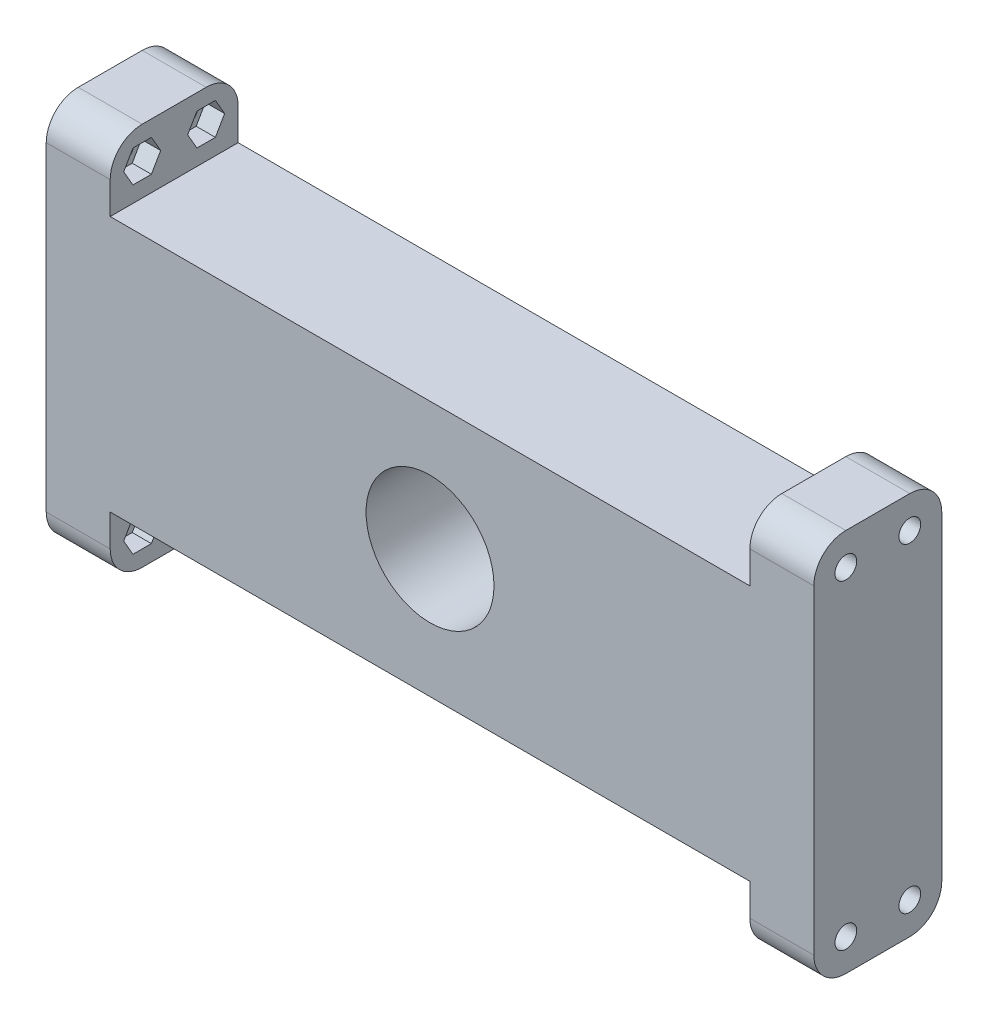
from build123d import *

# Parameters (mm, degrees)
SKETCH1_W                                  = 120
SKETCH1_H                                  = 60
BOSS_EXTRUDE1_DEPTH                        = 10
CUT_EXTRUDE1_DEPTH                         = 71
CUT_EXTRUDE1_DEPTH_BACK                    = 71
SKETCH2_W                                  = 100
SKETCH2_H                                  = 10
FILLET1_R                                  = 5
SKETCH4_R                                  = 1.7
CUT_EXTRUDE3_DEPTH                         = 115.455231423
CUT_EXTRUDE4_DEPTH                         = 3
MIRROR1_AT_THE_SECOND_PLANE_COPY_1_SKETC_R = 1.7
MIRROR1_AT_THE_SECOND_PLANE_COPY_1_DEPTH   = 115.455231423
MIRROR1_AT_THE_SECOND_PLANE_COPY_2_DEPTH   = 3
MIRROR2_COPY_1_SKETCH_R                    = 1.7
MIRROR2_COPY_1_DEPTH                       = 115.455231423
MIRROR2_COPY_2_DEPTH                       = 3
MIRROR2_COPY_3_SKETCH_R                    = 1.7
MIRROR2_COPY_3_DEPTH                       = 115.455231423
MIRROR2_COPY_4_DEPTH                       = 3
MIRROR2_COPY_5_SKETCH_R                    = 1.7
MIRROR2_COPY_5_DEPTH                       = 115.455231423
MIRROR2_COPY_6_DEPTH                       = 3
MIRROR2_COPY_7_SKETCH_R                    = 1.7
MIRROR2_COPY_7_DEPTH                       = 115.455231423
SKETCH6_R                                  = 10
CUT_EXTRUDE5_DEPTH                         = 71


with BuildPart() as part:
    # Sketch1 → Boss-Extrude1 (new, symmetric)
    with BuildSketch(Plane.XY):
        Rectangle(SKETCH1_W, SKETCH1_H)
    extrude(amount=BOSS_EXTRUDE1_DEPTH, both=True)

    # Sketch2 → Cut-Extrude1 (cut, two sides: drawn at the far end of the back side and taken through both)
    with BuildSketch(Plane.XY.offset(10).offset(-CUT_EXTRUDE1_DEPTH_BACK)):
        with Locations((0, -25)):
            Rectangle(SKETCH2_W, SKETCH2_H)
        with Locations((0, 25)):
            Rectangle(SKETCH2_W, SKETCH2_H)
    extrude(amount=CUT_EXTRUDE1_DEPTH + CUT_EXTRUDE1_DEPTH_BACK, mode=Mode.SUBTRACT)

    # Fillet1
    fillet1_edges = [part.edges().sort_by_distance(p)[0] for p in [
        (55, -30, -10),
        (-55, 30, -10),
        (-55, -30, 10),
        (-55, 30, 10),
        (55, -30, 10),
        (-55, -30, -10),
        (55, 30, -10),
        (55, 30, 10),
    ]]
    fillet(fillet1_edges, radius=FILLET1_R)

    # Sketch4 → Cut-Extrude3 (cut, symmetric)
    with BuildSketch(Plane.ZY.offset(-50)):
        with Locations((-5, 25)):
            Circle(SKETCH4_R)
    cut_extrude3 = extrude(amount=CUT_EXTRUDE3_DEPTH, both=True, mode=Mode.SUBTRACT)

    # Sketch5 → Cut-Extrude4 (cut)
    with BuildSketch(Plane.ZY.offset(-50)):
        Polygon((-7.886751346, 25), (-6.443375673, 22.5), (-3.556624327, 22.5), (-2.113248654, 25), (-3.556624327, 27.5), (-6.443375673, 27.5), align=None)
    cut_extrude4 = extrude(amount=-CUT_EXTRUDE4_DEPTH, mode=Mode.SUBTRACT)

    # Mirror1: Cut-Extrude3, Cut-Extrude4 across plane
    add(cut_extrude3.mirror(Plane(origin=(0, 0, 0), x_dir=(0, 0, 1), z_dir=(1, 0, 0))), mode=Mode.SUBTRACT)
    add(cut_extrude4.mirror(Plane(origin=(0, 0, 0), x_dir=(0, 0, 1), z_dir=(1, 0, 0))), mode=Mode.SUBTRACT)

    # Mirror1 at the second plane: Cut-Extrude3, Cut-Extrude4 across plane
    add(cut_extrude3.mirror(Plane.XY), mode=Mode.SUBTRACT)
    add(cut_extrude4.mirror(Plane.XY), mode=Mode.SUBTRACT)

    # Mirror1 at the second plane copy 1 sketc → Mirror1 at the second plane copy 1 (cut, symmetric)
    with BuildSketch(Plane(origin=(-50, 0, 0), x_dir=(0, 0, -1), z_dir=(1, 0, 0))):
        with Locations((-5, 25)):
            Circle(MIRROR1_AT_THE_SECOND_PLANE_COPY_1_SKETC_R)
    extrude(amount=MIRROR1_AT_THE_SECOND_PLANE_COPY_1_DEPTH, both=True, mode=Mode.SUBTRACT)

    # Mirror1 at the second plane copy 2 sketc → Mirror1 at the second plane copy 2 (cut)
    with BuildSketch(Plane(origin=(-50, 0, 0), x_dir=(0, 0, -1), z_dir=(1, 0, 0))):
        Polygon((-7.886751346, 25), (-6.443375673, 22.5), (-3.556624327, 22.5), (-2.113248654, 25), (-3.556624327, 27.5), (-6.443375673, 27.5), align=None)
    extrude(amount=-MIRROR1_AT_THE_SECOND_PLANE_COPY_2_DEPTH, mode=Mode.SUBTRACT)

    # Mirror2: Cut-Extrude4 across plane
    add(cut_extrude4.mirror(Plane.ZX), mode=Mode.SUBTRACT)

    # Mirror2 copy 1 sketch → Mirror2 copy 1 (cut, symmetric)
    with BuildSketch(Plane(origin=(-50, 0, 0), x_dir=(0, 0, 1), z_dir=(1, 0, 0))):
        with Locations((-5, 25)):
            Circle(MIRROR2_COPY_1_SKETCH_R)
    extrude(amount=MIRROR2_COPY_1_DEPTH, both=True, mode=Mode.SUBTRACT)

    # Mirror2 copy 2 sketch → Mirror2 copy 2 (cut)
    with BuildSketch(Plane(origin=(-50, 0, 0), x_dir=(0, 0, 1), z_dir=(1, 0, 0))):
        Polygon((-7.886751346, 25), (-6.443375673, 22.5), (-3.556624327, 22.5), (-2.113248654, 25), (-3.556624327, 27.5), (-6.443375673, 27.5), align=None)
    extrude(amount=-MIRROR2_COPY_2_DEPTH, mode=Mode.SUBTRACT)

    # Mirror2 copy 3 sketch → Mirror2 copy 3 (cut, symmetric)
    with BuildSketch(Plane(origin=(50, 0, 0), x_dir=(0, 0, -1), z_dir=(-1, 0, 0))):
        with Locations((-5, 25)):
            Circle(MIRROR2_COPY_3_SKETCH_R)
    extrude(amount=MIRROR2_COPY_3_DEPTH, both=True, mode=Mode.SUBTRACT)

    # Mirror2 copy 4 sketch → Mirror2 copy 4 (cut)
    with BuildSketch(Plane(origin=(50, 0, 0), x_dir=(0, 0, -1), z_dir=(-1, 0, 0))):
        Polygon((-7.886751346, 25), (-6.443375673, 22.5), (-3.556624327, 22.5), (-2.113248654, 25), (-3.556624327, 27.5), (-6.443375673, 27.5), align=None)
    extrude(amount=-MIRROR2_COPY_4_DEPTH, mode=Mode.SUBTRACT)

    # Mirror2 copy 5 sketch → Mirror2 copy 5 (cut, symmetric)
    with BuildSketch(Plane(origin=(-50, 0, 0), x_dir=(0, 0, -1), z_dir=(1, 0, 0))):
        with Locations((-5, -25)):
            Circle(MIRROR2_COPY_5_SKETCH_R)
    extrude(amount=MIRROR2_COPY_5_DEPTH, both=True, mode=Mode.SUBTRACT)

    # Mirror2 copy 6 sketch → Mirror2 copy 6 (cut)
    with BuildSketch(Plane(origin=(-50, 0, 0), x_dir=(0, 0, -1), z_dir=(1, 0, 0))):
        Polygon((-7.886751346, -25), (-6.443375673, -22.5), (-3.556624327, -22.5), (-2.113248654, -25), (-3.556624327, -27.5), (-6.443375673, -27.5), align=None)
    extrude(amount=-MIRROR2_COPY_6_DEPTH, mode=Mode.SUBTRACT)

    # Mirror2 copy 7 sketch → Mirror2 copy 7 (cut, symmetric)
    with BuildSketch(Plane.ZY.offset(-50)):
        with Locations((-5, -25)):
            Circle(MIRROR2_COPY_7_SKETCH_R)
    extrude(amount=MIRROR2_COPY_7_DEPTH, both=True, mode=Mode.SUBTRACT)

    # Sketch6 → Cut-Extrude5 (cut, through all)
    with BuildSketch(Plane.XY.offset(10)):
        Circle(SKETCH6_R)
    extrude(amount=-CUT_EXTRUDE5_DEPTH, mode=Mode.SUBTRACT)


solid = part.part
